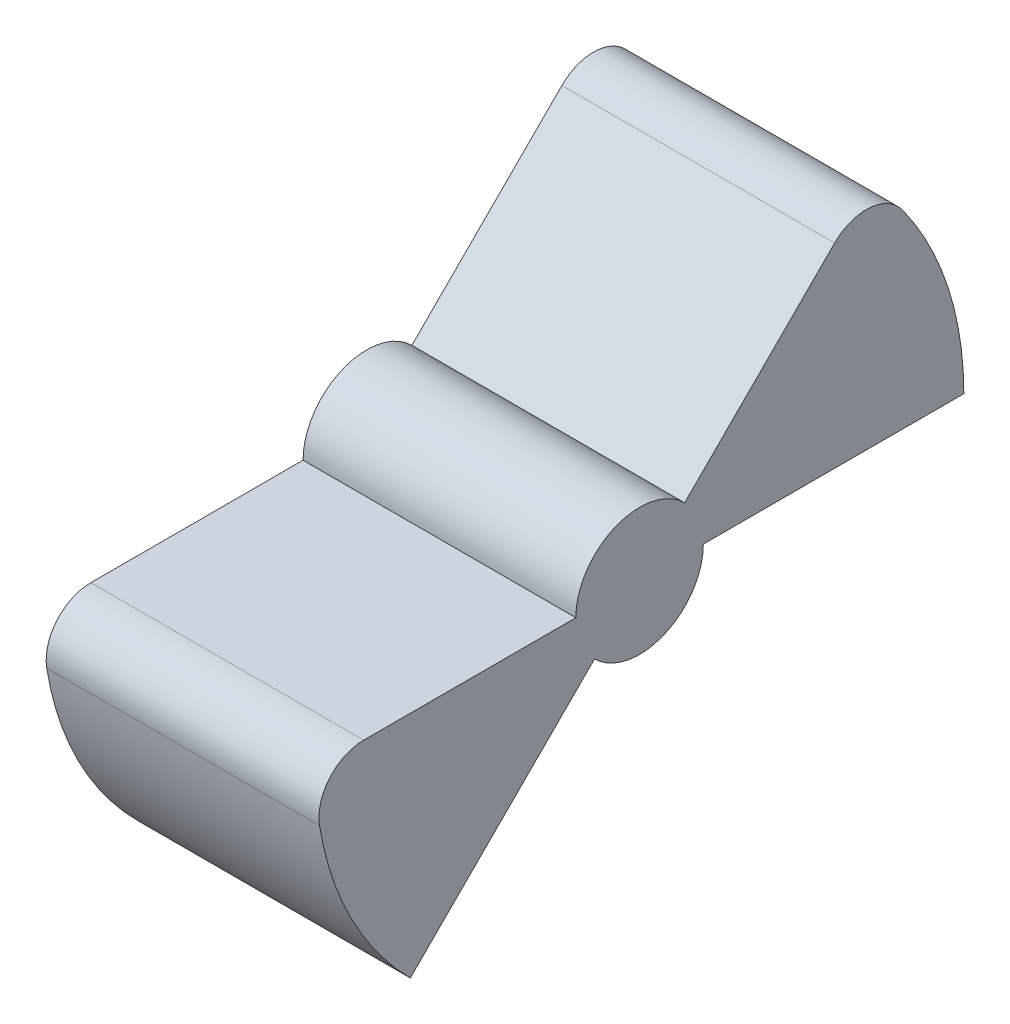
from build123d import *

# Parameters (mm, degrees)
BOSS_EXTRUDE1_DEPTH = 6.1


with BuildPart() as part:
    # Sketch2 → Boss-Extrude1 (new, symmetric)
    with BuildSketch(Plane(origin=(0, 0, 0), x_dir=(0, 0, -1), z_dir=(1, 0, 0))):
        with BuildLine():
            Line((2.015254326, 2.015254326), (8.724964183, 8.724964183))
            ThreePointArc((8.724964183, 8.724964183), (10.299695568, 9.304298721), (11.761446185, 8.48047072))
            ThreePointArc((11.761446185, 8.48047072), (13.798387038, 4.455840567), (14.5, 0))
            Line((14.5, 0), (2.85, 0))
            ThreePointArc((2.85, 0), (1.090647782, -2.633056668), (-2.015254326, -2.015254326))
            Line((-2.015254326, -2.015254326), (-10.253048327, -10.253048327))
            ThreePointArc((-10.253048327, -10.253048327), (-12.907688125, -6.606177963), (-14.313196708, -2.32))
            ThreePointArc((-14.313196708, -2.32), (-13.8621173, -0.70385186), (-12.338962679, 0))
            Line((-12.338962679, 0), (-2.85, 0))
            ThreePointArc((-2.85, 0), (-1.090647782, 2.633056668), (2.015254326, 2.015254326))
        make_face()
    extrude(amount=BOSS_EXTRUDE1_DEPTH, both=True)


solid = part.part
